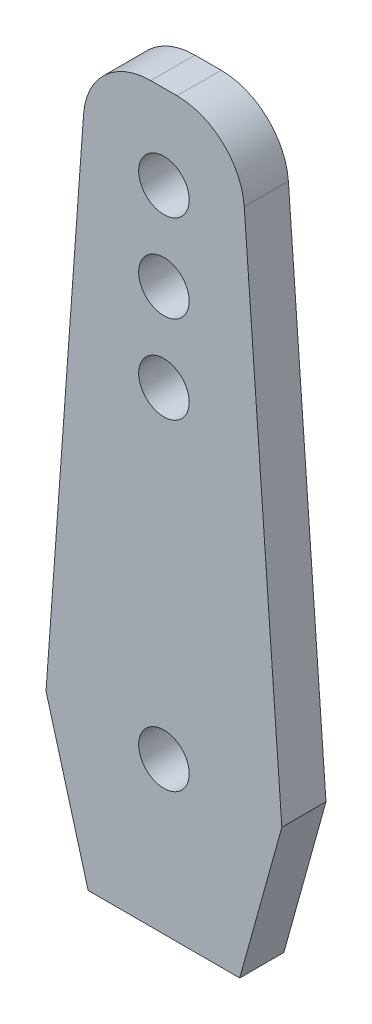
from build123d import *

# Parameters (mm, degrees)
SKETCH2_R           = 1.5
BOSS_EXTRUDE1_DEPTH = 2.62


with BuildPart() as part:
    # Sketch2 → Boss-Extrude1 (new body)
    with BuildSketch(Plane.XY):
        with BuildLine():
            Line((-0.779366827, 34.5), (0.779366827, 34.5))
            ThreePointArc((0.779366827, 34.5), (3.503665988, 33.428855422), (4.768906011, 30.789097042))
            Line((4.768906011, 30.789097042), (7, 0))
            Line((7, 0), (4.5, -9))
            Line((4.5, -9), (-4.5, -9))
            Line((-4.5, -9), (-7, 0))
            Line((-7, 0), (-4.768906011, 30.789097042))
            ThreePointArc((-4.768906011, 30.789097042), (-3.503665988, 33.428855422), (-0.779366827, 34.5))
        make_face()
        Circle(SKETCH2_R, mode=Mode.SUBTRACT)
        with Locations((0, 19.1)):
            Circle(SKETCH2_R, mode=Mode.SUBTRACT)
        with Locations((0, 24.3)):
            Circle(SKETCH2_R, mode=Mode.SUBTRACT)
        with Locations((0, 29.5)):
            Circle(SKETCH2_R, mode=Mode.SUBTRACT)
    extrude(amount=BOSS_EXTRUDE1_DEPTH)


solid = part.part
